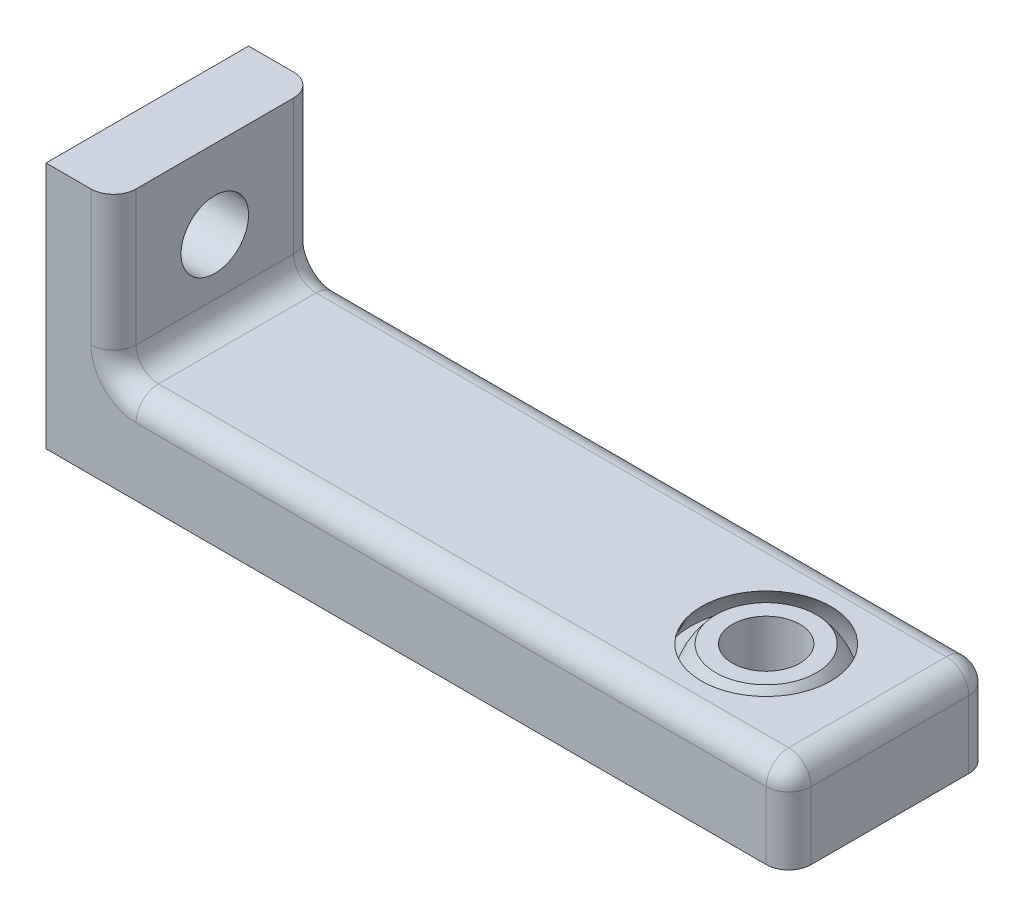
from build123d import *
from build123d.topology import SkipClean

# Parameters (mm, degrees)
CUT_EXTRUDE1_DEPTH       = 10
CUT_EXTRUDE1_DEPTH_BACK  = 10
SKETCH2_R                = 1.5
BOSS_EXTRUDE1_DEPTH      = 2
BOSS_EXTRUDE1_DEPTH_BACK = 2
SKETCH4_W                = 33
SKETCH4_H                = 9
CUT_EXTRUDE2_DEPTH       = 1.5
CUT_EXTRUDE2_DEPTH_BACK  = 10
SKETCH5_R                = 1.5
CUT_EXTRUDE3_DEPTH       = 10
CUT_EXTRUDE3_DEPTH_BACK  = 10
SKETCH8_R                = 1.5
SKETCH9_W                = 8.987494889
SKETCH9_H                = 0.781338227
SKETCH9_H_2              = 1.225544695
CUT_EXTRUDE4_DEPTH       = 46
SKETCH10_W               = 5.5
SKETCH10_H               = 2
CUT_EXTRUDE5_DEPTH       = 30
SKETCH11_W               = 3
SKETCH11_H               = 9
BOSS_EXTRUDE2_DEPTH      = 7
SKETCH12_R               = 1.5
CUT_EXTRUDE6_DEPTH       = 7
FILLET1_R                = 1
FILLET2_R                = 1
FILLET3_R                = 1
FILLET4_R                = 1


with BuildPart() as part:
    # Sketch1 → Revolve1 (revolve)
    with BuildSketch(Plane.XY):
        with BuildLine():
            Line((0, 0), (-6, 0))
            ThreePointArc((-6, 0), (-3, 3), (0, 0))
        make_face()
    revolve(axis=Axis((0, 0, 0), (-1, 0, 0)))

    # Sketch2 → Cut-Extrude1 (cut, two sides: drawn at the far end of the back side and taken through both)
    with BuildSketch(Plane(origin=(0, 0, 0), x_dir=(1, 0, 0), z_dir=(0, 1, 0)).offset(-CUT_EXTRUDE1_DEPTH_BACK)):
        with Locations((-3, 0)):
            Circle(SKETCH2_R)
    extrude(amount=CUT_EXTRUDE1_DEPTH + CUT_EXTRUDE1_DEPTH_BACK, mode=Mode.SUBTRACT)

    # Sketch4 → Boss-Extrude1 (add, two sides: drawn at the far end of the back side and taken through both)
    with SkipClean():  # the faces are left unmerged after this step: merging them gives an invalid solid
        with BuildSketch(Plane(origin=(0, 0, 0), x_dir=(1, 0, 0), z_dir=(0, 1, 0)).offset(-BOSS_EXTRUDE1_DEPTH_BACK)):
            with Locations((-14, 0)):
                Rectangle(SKETCH4_W, SKETCH4_H)
        extrude(amount=BOSS_EXTRUDE1_DEPTH + BOSS_EXTRUDE1_DEPTH_BACK)

    # Sketch5 → Cut-Extrude2 (cut, two sides: drawn at the far end of the back side and taken through both)
    with SkipClean():  # the faces are left unmerged after this step: merging them gives an invalid solid
        with BuildSketch(Plane(origin=(0, 2, 0), x_dir=(1, 0, 0), z_dir=(0, 1, 0)).offset(-CUT_EXTRUDE2_DEPTH_BACK)):
            with Locations((-3, 0)):
                Circle(SKETCH5_R)
        extrude(amount=CUT_EXTRUDE2_DEPTH + CUT_EXTRUDE2_DEPTH_BACK, mode=Mode.SUBTRACT)

    # Sketch6 → Cut-Revolve1 (revolve, cut)
    with BuildSketch(Plane(origin=(0, 0, 0), x_dir=(1, 0, 0), z_dir=(0, 1, 0))):
        with BuildLine():
            Line((-3, 3.5), (-3, -3.5))
            ThreePointArc((-3, -3.5), (-6.5, 0), (-3, 3.5))
        make_face()
    revolve(axis=Axis((-3, 0, -3.5), (0, 0, 1)), mode=Mode.SUBTRACT)

    # Sketch10 → Cut-Extrude5 (cut)
    with BuildSketch(Plane.ZY.offset(30.5)):
        Rectangle(SKETCH10_W, SKETCH10_H)
    extrude(amount=-CUT_EXTRUDE5_DEPTH, mode=Mode.SUBTRACT)

    # Sketch11 → Boss-Extrude2 (add)
    with BuildSketch(Plane(origin=(0, 2, 0), x_dir=(1, 0, 0), z_dir=(0, 1, 0))):
        with Locations((-29, 0)):
            Rectangle(SKETCH11_W, SKETCH11_H)
    extrude(amount=BOSS_EXTRUDE2_DEPTH)

    # Sketch12 → Cut-Extrude6 (cut)
    with BuildSketch(Plane(origin=(-27.5, 0, 0), x_dir=(0, 0, -1), z_dir=(1, 0, 0))):
        with Locations((0, 5.5)):
            Circle(SKETCH12_R)
    extrude(amount=-CUT_EXTRUDE6_DEPTH, mode=Mode.SUBTRACT)

    # Fillet1
    fillet1_edges = [part.edges().sort_by_distance(p)[0] for p in [
        (2.5, 0, -4.5),
    ]]
    fillet(fillet1_edges, radius=FILLET1_R)

    # Fillet2
    fillet2_edges = [part.edges().sort_by_distance(p)[0] for p in [
        (2.5, 0, 4.5),
    ]]
    fillet(fillet2_edges, radius=FILLET2_R)

    # Fillet3
    fillet3_edges = [part.edges().sort_by_distance(p)[0] for p in [
        (-27.5, 2, 0),
    ]]
    fillet(fillet3_edges, radius=FILLET3_R)

    # Fillet4
    fillet4_edges = [part.edges().sort_by_distance(p)[0] for p in [
        (-27.5, 6, 4.5),
        (-27.207106781, 2.292893219, 4.5),
        (-12.5, 2, 4.5),
        (2.207106781, 2, 4.207106781),
        (2.5, 2, 0),
        (2.207106781, 2, -4.207106781),
        (-27.5, 6, -4.5),
        (-27.207106781, 2.292893219, -4.5),
        (-12.5, 2, -4.5),
    ]]
    fillet(fillet4_edges, radius=FILLET4_R)


with BuildPart() as body_2:
    # Sketch7 → Revolve2 (revolve)
    with BuildSketch(Plane(origin=(0, 0, 0), x_dir=(1, 0, 0), z_dir=(0, 1, 0))):
        with BuildLine():
            Line((-3, 3), (-3, -3))
            ThreePointArc((-3, -3), (-6, 0), (-3, 3))
        make_face()
    revolve(axis=Axis((-3, 0, -3), (0, 0, 1)))

    # Sketch8 → Cut-Extrude3 (cut, two sides: drawn at the far end of the back side and taken through both)
    with BuildSketch(Plane(origin=(0, 0, 0), x_dir=(1, 0, 0), z_dir=(0, 1, 0)).offset(-CUT_EXTRUDE3_DEPTH_BACK)):
        with Locations((-3, 0)):
            Circle(SKETCH8_R)
    extrude(amount=CUT_EXTRUDE3_DEPTH + CUT_EXTRUDE3_DEPTH_BACK, mode=Mode.SUBTRACT)

    # Sketch9 → Cut-Extrude4 (cut)
    with BuildSketch(Plane.ZY.offset(30.5)):
        with Locations((-0.006252555, 2.390669113)):
            Rectangle(SKETCH9_W, SKETCH9_H)
        with Locations((-0.006252555, -2.612772347)):
            Rectangle(SKETCH9_W, SKETCH9_H_2)
    extrude(amount=-CUT_EXTRUDE4_DEPTH, mode=Mode.SUBTRACT)


solid = Compound([part.part, body_2.part])
